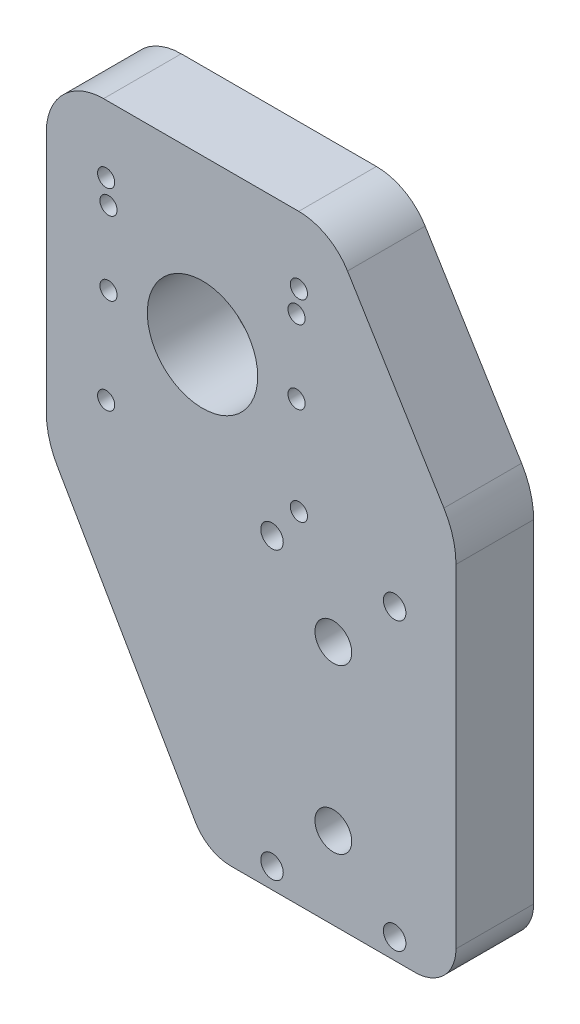
from build123d import *

# Parameters (mm, degrees)
BOSS_EXTRUDE1_DEPTH     = 19
FILLET1_R               = 10
SKETCH2_R               = 13.5
CUT_EXTRUDE1_DEPTH      = 20
TAP_DRILL_FOR_M5_TAP1_D = 4.2
M5_CLEARANCE_HOLE1_D    = 5.5
TAP_DRILL_FOR_M5_TAP2_D = 4.2
FILLET2_R               = 4
BOSS_EXTRUDE2_DEPTH     = 19
M8_CLEARANCE_HOLE1_D    = 9


with BuildPart() as part:
    # Sketch1 → Boss-Extrude1 (new body)
    with BuildSketch(Plane.XY):
        with BuildLine():
            Line((-170.200000001, 540.824594888), (-129.309401077, 470))
            Line((-129.309401077, 470), (-93, 470))
            ThreePointArc((-93, 470), (-90.878679656, 470.878679656), (-90, 473))
            Line((-90, 473), (-90, 564.25527297))
            Line((-90, 564.25527297), (-116.225329238, 607))
            Line((-116.225329238, 607), (-170.200000001, 607))
            Line((-170.200000001, 607), (-170.200000001, 540.824594888))
        make_face()
    extrude(amount=BOSS_EXTRUDE1_DEPTH)

    # Fillet1
    fillet1_edges = [part.edges().sort_by_distance(p)[0] for p in [
        (-90, 564.25527297, 9.5),
        (-129.309401077, 470, 9.5),
        (-170.200000001, 540.824594888, 9.5),
    ]]
    fillet(fillet1_edges, radius=FILLET1_R)

    # Sketch2 → Cut-Extrude1 (cut)
    with BuildSketch(Plane.XY.offset(19)):
        with Locations((-142.000000001, 577)):
            Circle(SKETCH2_R)
    extrude(amount=-CUT_EXTRUDE1_DEPTH, mode=Mode.SUBTRACT)

    # Tap Drill for M5 Tap1 (through all)
    with Locations(Plane(origin=(0, 0, 0), x_dir=(-1, 0, 0), z_dir=(0, 0, -1))):
        with Locations((119.000000001, 595), (119.000000001, 577), (165.000000001, 577), (165.000000001, 595)):
            Hole(TAP_DRILL_FOR_M5_TAP1_D / 2)

    # M5 Clearance Hole1 (through all)
    with Locations(Plane.XY.offset(19)):
        with Locations((-95, 545), (-125, 545), (-125, 475), (-95, 475), (-110, 490), (-110, 530)):
            Hole(M5_CLEARANCE_HOLE1_D / 2)

    # Tap Drill for M5 Tap2 (through all)
    with Locations(Plane.XY.offset(19)):
        with Locations((-165.570000001, 553.43), (-165.570000001, 600.57), (-118.430000001, 553.43), (-118.430000001, 600.57)):
            Hole(TAP_DRILL_FOR_M5_TAP2_D / 2)

    # Fillet2
    fillet2_edges = [part.edges().sort_by_distance(p)[0] for p in [
        (-116.225329238, 607, 9.5),
        (-170.200000001, 607, 9.5),
    ]]
    fillet(fillet2_edges, radius=FILLET2_R)

    # Sketch11 → Boss-Extrude2 (add)
    with BuildSketch(Plane.XY.offset(19)):
        with BuildLine():
            ThreePointArc((-80, 561.432106106), (-80.75234172, 566.866041212), (-82.952765074, 571.89115871))
            Line((-82.952765074, 571.89115871), (-106.530973281, 610.321336823))
            ThreePointArc((-106.530973281, 610.321336823), (-111.626593598, 615.216765438), (-118.464037729, 617))
            Line((-118.464037729, 617), (-166.200000001, 617))
            ThreePointArc((-166.200000001, 617), (-176.099494937, 612.899494937), (-180.200000001, 603))
            Line((-180.200000001, 603), (-180.200000001, 543.504086813))
            ThreePointArc((-180.200000001, 543.504086813), (-179.518516526, 538.327705911), (-177.520508076, 533.504086813))
            Line((-177.520508076, 533.504086813), (-143.743157806, 475))
            ThreePointArc((-143.743157806, 475), (-140.082903769, 471.339745962), (-135.082903769, 470))
            Line((-135.082903769, 470), (-123.535898385, 470))
            ThreePointArc((-123.535898385, 470), (-128.535898385, 471.339745962), (-132.196152423, 475))
            Line((-132.196152423, 475), (-168.860254039, 538.504086813))
            ThreePointArc((-168.860254039, 538.504086813), (-169.859258264, 540.915896362), (-170.200000001, 543.504086813))
            Line((-170.200000001, 543.504086813), (-170.200000001, 603))
            ThreePointArc((-170.200000001, 603), (-169.028427125, 605.828427125), (-166.200000001, 607))
            Line((-166.200000001, 607), (-118.464037729, 607))
            ThreePointArc((-118.464037729, 607), (-116.510482263, 606.490504411), (-115.054590744, 605.091810521))
            Line((-115.054590744, 605.091810521), (-91.476382537, 566.661632408))
            ThreePointArc((-91.476382537, 566.661632408), (-90.37617086, 564.149073659), (-90, 561.432106106))
            Line((-90, 561.432106106), (-90, 473))
            ThreePointArc((-90, 473), (-90.878679656, 470.878679656), (-93, 470))
            Line((-93, 470), (-90, 470))
            ThreePointArc((-90, 470), (-82.928932188, 472.928932188), (-80, 480))
            Line((-80, 480), (-80, 561.432106106))
        make_face()
    extrude(amount=-BOSS_EXTRUDE2_DEPTH)

    # M8 Clearance Hole1 (through all)
    with Locations(Plane(origin=(-110, 490, 0), x_dir=(-1, 0, 0), z_dir=(0, 0, -1))):
        with Locations((0, 0), (0, 40)):
            Hole(M8_CLEARANCE_HOLE1_D / 2)


solid = part.part
